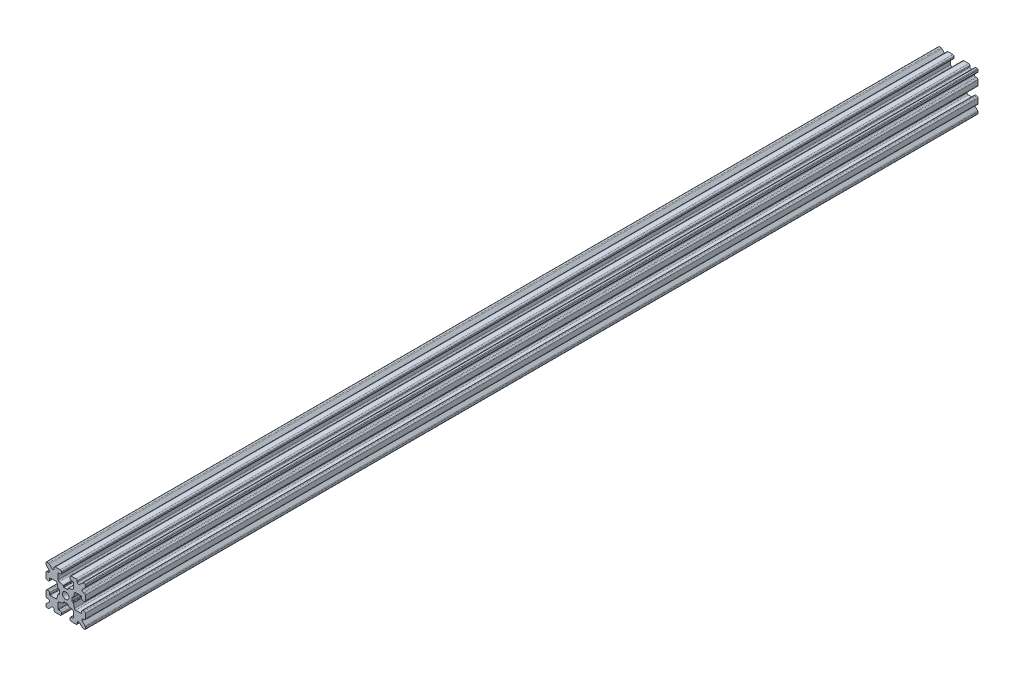
from build123d import *

# Parameters (mm, degrees)
CROQUIS1_R              = 1.25
SALIENTE_EXTRUIR1_DEPTH = 300
CROQUIS2_R              = 1.25
SALIENTE_EXTRUIR2_DEPTH = 40


with BuildPart() as part:
    # Croquis1 → Saliente-Extruir1 (new body)
    with BuildSketch(Plane(origin=(0, 0, -150), x_dir=(-1, 0, 0), z_dir=(0, 0, -1))):
        with BuildLine():
            Line((-2.9, -5.9), (-2.9, -3.80033659))
            ThreePointArc((-2.9, -3.80033659), (-2.790306203, -3.487828881), (-2.509355728, -3.312441801))
            Line((-2.509355728, -3.312441801), (-0.981757709, -2.970049142))
            ThreePointArc((-0.981757709, -2.970049142), (-0.869377519, -2.89989431), (-0.8255, -2.774891226))
            Line((-0.8255, -2.774891226), (-0.8255, -2.5470646))
            ThreePointArc((-0.8255, -2.5470646), (-0.766921356, -2.405643244), (-0.6255, -2.3470646))
            Line((-0.6255, -2.3470646), (0.6255, -2.3470646))
            ThreePointArc((0.6255, -2.3470646), (0.766921356, -2.405643244), (0.8255, -2.5470646))
            Line((0.8255, -2.5470646), (0.8255, -2.774891226))
            ThreePointArc((0.8255, -2.774891226), (0.869377519, -2.89989431), (0.981757709, -2.970049142))
            Line((0.981757709, -2.970049142), (2.509355728, -3.312441801))
            ThreePointArc((2.509355728, -3.312441801), (2.790306203, -3.487828881), (2.9, -3.80033659))
            Line((2.9, -3.80033659), (2.9, -5.9))
            ThreePointArc((2.9, -5.9), (2.841421356, -6.041421356), (2.7, -6.1))
            Line((2.7, -6.1), (2.1, -6.1))
            ThreePointArc((2.1, -6.1), (1.746446609, -6.246446609), (1.6, -6.6))
            Line((1.6, -6.6), (1.6, -7))
            ThreePointArc((1.6, -7), (1.746446609, -7.353553391), (2.1, -7.5))
            Line((2.1, -7.5), (3.9, -7.5))
            ThreePointArc((3.9, -7.5), (4.253553391, -7.353553391), (4.4, -7))
            Line((4.4, -7), (4.4, -6.667766953))
            ThreePointArc((4.4, -6.667766953), (4.708658284, -6.205827187), (5.253553391, -6.314213562))
            Line((5.253553391, -6.314213562), (6.292893219, -7.353553391))
            ThreePointArc((6.292893219, -7.353553391), (6.455104893, -7.461939766), (6.646446609, -7.5))
            Line((6.646446609, -7.5), (7.25, -7.5))
            ThreePointArc((7.25, -7.5), (7.426776695, -7.426776695), (7.5, -7.25))
            Line((7.5, -7.25), (7.5, -6.646446609))
            ThreePointArc((7.5, -6.646446609), (7.461939766, -6.455104893), (7.353553391, -6.292893219))
            Line((7.353553391, -6.292893219), (6.314213562, -5.253553391))
            ThreePointArc((6.314213562, -5.253553391), (6.205827187, -4.708658284), (6.667766953, -4.4))
            Line((6.667766953, -4.4), (7, -4.4))
            ThreePointArc((7, -4.4), (7.353553391, -4.253553391), (7.5, -3.9))
            Line((7.5, -3.9), (7.5, -2.1))
            ThreePointArc((7.5, -2.1), (7.353553391, -1.746446609), (7, -1.6))
            Line((7, -1.6), (6.6, -1.6))
            ThreePointArc((6.6, -1.6), (6.246446609, -1.746446609), (6.1, -2.1))
            Line((6.1, -2.1), (6.1, -2.7))
            ThreePointArc((6.1, -2.7), (6.041421356, -2.841421356), (5.9, -2.9))
            Line((5.9, -2.9), (3.80033659, -2.9))
            ThreePointArc((3.80033659, -2.9), (3.487828881, -2.790306203), (3.312441801, -2.509355728))
            Line((3.312441801, -2.509355728), (2.970049142, -0.981757709))
            ThreePointArc((2.970049142, -0.981757709), (2.89989431, -0.869377519), (2.774891226, -0.8255))
            Line((2.774891226, -0.8255), (2.5470646, -0.8255))
            ThreePointArc((2.5470646, -0.8255), (2.405643244, -0.766921356), (2.3470646, -0.6255))
            Line((2.3470646, -0.6255), (2.3470646, 0.6255))
            ThreePointArc((2.3470646, 0.6255), (2.405643244, 0.766921356), (2.5470646, 0.8255))
            Line((2.5470646, 0.8255), (2.774891226, 0.8255))
            ThreePointArc((2.774891226, 0.8255), (2.89989431, 0.869377519), (2.970049142, 0.981757709))
            Line((2.970049142, 0.981757709), (3.312441801, 2.509355728))
            ThreePointArc((3.312441801, 2.509355728), (3.487828881, 2.790306203), (3.80033659, 2.9))
            Line((3.80033659, 2.9), (5.9, 2.9))
            ThreePointArc((5.9, 2.9), (6.041421356, 2.841421356), (6.1, 2.7))
            Line((6.1, 2.7), (6.1, 2.1))
            ThreePointArc((6.1, 2.1), (6.246446609, 1.746446609), (6.6, 1.6))
            Line((6.6, 1.6), (7, 1.6))
            ThreePointArc((7, 1.6), (7.353553391, 1.746446609), (7.5, 2.1))
            Line((7.5, 2.1), (7.5, 3.9))
            ThreePointArc((7.5, 3.9), (7.353553391, 4.253553391), (7, 4.4))
            Line((7, 4.4), (6.667766953, 4.4))
            ThreePointArc((6.667766953, 4.4), (6.205827187, 4.708658284), (6.314213562, 5.253553391))
            Line((6.314213562, 5.253553391), (7.353553391, 6.292893219))
            ThreePointArc((7.353553391, 6.292893219), (7.461939766, 6.455104893), (7.5, 6.646446609))
            Line((7.5, 6.646446609), (7.5, 7.25))
            ThreePointArc((7.5, 7.25), (7.426776695, 7.426776695), (7.25, 7.5))
            Line((7.25, 7.5), (6.646446609, 7.5))
            ThreePointArc((6.646446609, 7.5), (6.455104893, 7.461939766), (6.292893219, 7.353553391))
            Line((6.292893219, 7.353553391), (5.253553391, 6.314213562))
            ThreePointArc((5.253553391, 6.314213562), (4.708658284, 6.205827187), (4.4, 6.667766953))
            Line((4.4, 6.667766953), (4.4, 7))
            ThreePointArc((4.4, 7), (4.253553391, 7.353553391), (3.9, 7.5))
            Line((3.9, 7.5), (2.1, 7.5))
            ThreePointArc((2.1, 7.5), (1.746446609, 7.353553391), (1.6, 7))
            Line((1.6, 7), (1.6, 6.6))
            ThreePointArc((1.6, 6.6), (1.746446609, 6.246446609), (2.1, 6.1))
            Line((2.1, 6.1), (2.7, 6.1))
            ThreePointArc((2.7, 6.1), (2.841421356, 6.041421356), (2.9, 5.9))
            Line((2.9, 5.9), (2.9, 3.80033659))
            ThreePointArc((2.9, 3.80033659), (2.790306203, 3.487828881), (2.509355728, 3.312441801))
            Line((2.509355728, 3.312441801), (0.981757709, 2.970049142))
            ThreePointArc((0.981757709, 2.970049142), (0.869377519, 2.89989431), (0.8255, 2.774891226))
            Line((0.8255, 2.774891226), (0.8255, 2.5470646))
            ThreePointArc((0.8255, 2.5470646), (0.766921356, 2.405643244), (0.6255, 2.3470646))
            Line((0.6255, 2.3470646), (-0.6255, 2.3470646))
            ThreePointArc((-0.6255, 2.3470646), (-0.766921356, 2.405643244), (-0.8255, 2.5470646))
            Line((-0.8255, 2.5470646), (-0.8255, 2.774891226))
            ThreePointArc((-0.8255, 2.774891226), (-0.869377519, 2.89989431), (-0.981757709, 2.970049142))
            Line((-0.981757709, 2.970049142), (-2.509355728, 3.312441801))
            ThreePointArc((-2.509355728, 3.312441801), (-2.790306203, 3.487828881), (-2.9, 3.80033659))
            Line((-2.9, 3.80033659), (-2.9, 5.9))
            ThreePointArc((-2.9, 5.9), (-2.841421356, 6.041421356), (-2.7, 6.1))
            Line((-2.7, 6.1), (-2.1, 6.1))
            ThreePointArc((-2.1, 6.1), (-1.746446609, 6.246446609), (-1.6, 6.6))
            Line((-1.6, 6.6), (-1.6, 7))
            ThreePointArc((-1.6, 7), (-1.746446609, 7.353553391), (-2.1, 7.5))
            Line((-2.1, 7.5), (-3.9, 7.5))
            ThreePointArc((-3.9, 7.5), (-4.253553391, 7.353553391), (-4.4, 7))
            Line((-4.4, 7), (-4.4, 6.667766953))
            ThreePointArc((-4.4, 6.667766953), (-4.708658284, 6.205827187), (-5.253553391, 6.314213562))
            Line((-5.253553391, 6.314213562), (-6.292893219, 7.353553391))
            ThreePointArc((-6.292893219, 7.353553391), (-6.455104893, 7.461939766), (-6.646446609, 7.5))
            Line((-6.646446609, 7.5), (-7.25, 7.5))
            ThreePointArc((-7.25, 7.5), (-7.426776695, 7.426776695), (-7.5, 7.25))
            Line((-7.5, 7.25), (-7.5, 6.646446609))
            ThreePointArc((-7.5, 6.646446609), (-7.461939766, 6.455104893), (-7.353553391, 6.292893219))
            Line((-7.353553391, 6.292893219), (-6.314213562, 5.253553391))
            ThreePointArc((-6.314213562, 5.253553391), (-6.205827187, 4.708658284), (-6.667766953, 4.4))
            Line((-6.667766953, 4.4), (-7, 4.4))
            ThreePointArc((-7, 4.4), (-7.353553391, 4.253553391), (-7.5, 3.9))
            Line((-7.5, 3.9), (-7.5, 2.1))
            ThreePointArc((-7.5, 2.1), (-7.353553391, 1.746446609), (-7, 1.6))
            Line((-7, 1.6), (-6.6, 1.6))
            ThreePointArc((-6.6, 1.6), (-6.246446609, 1.746446609), (-6.1, 2.1))
            Line((-6.1, 2.1), (-6.1, 2.7))
            ThreePointArc((-6.1, 2.7), (-6.041421356, 2.841421356), (-5.9, 2.9))
            Line((-5.9, 2.9), (-3.80033659, 2.9))
            ThreePointArc((-3.80033659, 2.9), (-3.487828881, 2.790306203), (-3.312441801, 2.509355728))
            Line((-3.312441801, 2.509355728), (-2.970049142, 0.981757709))
            ThreePointArc((-2.970049142, 0.981757709), (-2.89989431, 0.869377519), (-2.774891226, 0.8255))
            Line((-2.774891226, 0.8255), (-2.5470646, 0.8255))
            ThreePointArc((-2.5470646, 0.8255), (-2.405643244, 0.766921356), (-2.3470646, 0.6255))
            Line((-2.3470646, 0.6255), (-2.3470646, -0.6255))
            ThreePointArc((-2.3470646, -0.6255), (-2.405643244, -0.766921356), (-2.5470646, -0.8255))
            Line((-2.5470646, -0.8255), (-2.774891226, -0.8255))
            ThreePointArc((-2.774891226, -0.8255), (-2.89989431, -0.869377519), (-2.970049142, -0.981757709))
            Line((-2.970049142, -0.981757709), (-3.312441801, -2.509355728))
            ThreePointArc((-3.312441801, -2.509355728), (-3.487828881, -2.790306203), (-3.80033659, -2.9))
            Line((-3.80033659, -2.9), (-5.9, -2.9))
            ThreePointArc((-5.9, -2.9), (-6.041421356, -2.841421356), (-6.1, -2.7))
            Line((-6.1, -2.7), (-6.1, -2.1))
            ThreePointArc((-6.1, -2.1), (-6.246446609, -1.746446609), (-6.6, -1.6))
            Line((-6.6, -1.6), (-7, -1.6))
            ThreePointArc((-7, -1.6), (-7.353553391, -1.746446609), (-7.5, -2.1))
            Line((-7.5, -2.1), (-7.5, -3.9))
            ThreePointArc((-7.5, -3.9), (-7.353553391, -4.253553391), (-7, -4.4))
            Line((-7, -4.4), (-6.667766953, -4.4))
            ThreePointArc((-6.667766953, -4.4), (-6.205827187, -4.708658284), (-6.314213562, -5.253553391))
            Line((-6.314213562, -5.253553391), (-7.353553391, -6.292893219))
            ThreePointArc((-7.353553391, -6.292893219), (-7.461939766, -6.455104893), (-7.5, -6.646446609))
            Line((-7.5, -6.646446609), (-7.5, -7.25))
            ThreePointArc((-7.5, -7.25), (-7.426776695, -7.426776695), (-7.25, -7.5))
            Line((-7.25, -7.5), (-6.646446609, -7.5))
            ThreePointArc((-6.646446609, -7.5), (-6.455104893, -7.461939766), (-6.292893219, -7.353553391))
            Line((-6.292893219, -7.353553391), (-5.253553391, -6.314213562))
            ThreePointArc((-5.253553391, -6.314213562), (-4.708658284, -6.205827187), (-4.4, -6.667766953))
            Line((-4.4, -6.667766953), (-4.4, -7))
            ThreePointArc((-4.4, -7), (-4.253553391, -7.353553391), (-3.9, -7.5))
            Line((-3.9, -7.5), (-2.1, -7.5))
            ThreePointArc((-2.1, -7.5), (-1.746446609, -7.353553391), (-1.6, -7))
            Line((-1.6, -7), (-1.6, -6.6))
            ThreePointArc((-1.6, -6.6), (-1.746446609, -6.246446609), (-2.1, -6.1))
            Line((-2.1, -6.1), (-2.7, -6.1))
            ThreePointArc((-2.7, -6.1), (-2.841421356, -6.041421356), (-2.9, -5.9))
        make_face()
        with Locations(Location((0, 0, 0), (0, 0, 180))):
            Circle(CROQUIS1_R, mode=Mode.SUBTRACT)
    extrude(amount=-SALIENTE_EXTRUIR1_DEPTH)

    # Croquis2 → Saliente-Extruir2 (add)
    with BuildSketch(Plane.XY.offset(150)):
        with BuildLine():
            Line((2.7, -6.1), (2.1, -6.1))
            ThreePointArc((2.1, -6.1), (1.746446609, -6.246446609), (1.6, -6.6))
            Line((1.6, -6.6), (1.6, -7))
            ThreePointArc((1.6, -7), (1.746446609, -7.353553391), (2.1, -7.5))
            Line((2.1, -7.5), (3.9, -7.5))
            ThreePointArc((3.9, -7.5), (4.253553391, -7.353553391), (4.4, -7))
            Line((4.4, -7), (4.4, -6.667766953))
            ThreePointArc((4.4, -6.667766953), (4.708658284, -6.205827187), (5.253553391, -6.314213562))
            Line((5.253553391, -6.314213562), (6.292893219, -7.353553391))
            ThreePointArc((6.292893219, -7.353553391), (6.455104893, -7.461939766), (6.646446609, -7.5))
            Line((6.646446609, -7.5), (7.25, -7.5))
            ThreePointArc((7.25, -7.5), (7.426776695, -7.426776695), (7.5, -7.25))
            Line((7.5, -7.25), (7.5, -6.646446609))
            ThreePointArc((7.5, -6.646446609), (7.461939766, -6.455104893), (7.353553391, -6.292893219))
            Line((7.353553391, -6.292893219), (6.314213562, -5.253553391))
            ThreePointArc((6.314213562, -5.253553391), (6.205827187, -4.708658284), (6.667766953, -4.4))
            Line((6.667766953, -4.4), (7, -4.4))
            ThreePointArc((7, -4.4), (7.353553391, -4.253553391), (7.5, -3.9))
            Line((7.5, -3.9), (7.5, -2.1))
            ThreePointArc((7.5, -2.1), (7.353553391, -1.746446609), (7, -1.6))
            Line((7, -1.6), (6.6, -1.6))
            ThreePointArc((6.6, -1.6), (6.246446609, -1.746446609), (6.1, -2.1))
            Line((6.1, -2.1), (6.1, -2.7))
            ThreePointArc((6.1, -2.7), (6.041421356, -2.841421356), (5.9, -2.9))
            Line((5.9, -2.9), (3.80033659, -2.9))
            ThreePointArc((3.80033659, -2.9), (3.487828881, -2.790306203), (3.312441801, -2.509355728))
            Line((3.312441801, -2.509355728), (2.970049142, -0.981757709))
            ThreePointArc((2.970049142, -0.981757709), (2.89989431, -0.869377519), (2.774891226, -0.8255))
            Line((2.774891226, -0.8255), (2.5470646, -0.8255))
            ThreePointArc((2.5470646, -0.8255), (2.405643244, -0.766921356), (2.3470646, -0.6255))
            Line((2.3470646, -0.6255), (2.3470646, 0.6255))
            ThreePointArc((2.3470646, 0.6255), (2.405643244, 0.766921356), (2.5470646, 0.8255))
            Line((2.5470646, 0.8255), (2.774891226, 0.8255))
            ThreePointArc((2.774891226, 0.8255), (2.89989431, 0.869377519), (2.970049142, 0.981757709))
            Line((2.970049142, 0.981757709), (3.312441801, 2.509355728))
            ThreePointArc((3.312441801, 2.509355728), (3.487828881, 2.790306203), (3.80033659, 2.9))
            Line((3.80033659, 2.9), (5.9, 2.9))
            ThreePointArc((5.9, 2.9), (6.041421356, 2.841421356), (6.1, 2.7))
            Line((6.1, 2.7), (6.1, 2.1))
            ThreePointArc((6.1, 2.1), (6.246446609, 1.746446609), (6.6, 1.6))
            Line((6.6, 1.6), (7, 1.6))
            ThreePointArc((7, 1.6), (7.353553391, 1.746446609), (7.5, 2.1))
            Line((7.5, 2.1), (7.5, 3.9))
            ThreePointArc((7.5, 3.9), (7.353553391, 4.253553391), (7, 4.4))
            Line((7, 4.4), (6.667766953, 4.4))
            ThreePointArc((6.667766953, 4.4), (6.205827187, 4.708658284), (6.314213562, 5.253553391))
            Line((6.314213562, 5.253553391), (7.353553391, 6.292893219))
            ThreePointArc((7.353553391, 6.292893219), (7.461939766, 6.455104893), (7.5, 6.646446609))
            Line((7.5, 6.646446609), (7.5, 7.25))
            ThreePointArc((7.5, 7.25), (7.426776695, 7.426776695), (7.25, 7.5))
            Line((7.25, 7.5), (6.646446609, 7.5))
            ThreePointArc((6.646446609, 7.5), (6.455104893, 7.461939766), (6.292893219, 7.353553391))
            Line((6.292893219, 7.353553391), (5.253553391, 6.314213562))
            ThreePointArc((5.253553391, 6.314213562), (4.708658284, 6.205827187), (4.4, 6.667766953))
            Line((4.4, 6.667766953), (4.4, 7))
            ThreePointArc((4.4, 7), (4.253553391, 7.353553391), (3.9, 7.5))
            Line((3.9, 7.5), (2.1, 7.5))
            ThreePointArc((2.1, 7.5), (1.746446609, 7.353553391), (1.6, 7))
            Line((1.6, 7), (1.6, 6.6))
            ThreePointArc((1.6, 6.6), (1.746446609, 6.246446609), (2.1, 6.1))
            Line((2.1, 6.1), (2.7, 6.1))
            ThreePointArc((2.7, 6.1), (2.841421356, 6.041421356), (2.9, 5.9))
            Line((2.9, 5.9), (2.9, 3.80033659))
            ThreePointArc((2.9, 3.80033659), (2.790306203, 3.487828881), (2.509355728, 3.312441801))
            Line((2.509355728, 3.312441801), (0.981757709, 2.970049142))
            ThreePointArc((0.981757709, 2.970049142), (0.869377519, 2.89989431), (0.8255, 2.774891226))
            Line((0.8255, 2.774891226), (0.8255, 2.5470646))
            ThreePointArc((0.8255, 2.5470646), (0.766921356, 2.405643244), (0.6255, 2.3470646))
            Line((0.6255, 2.3470646), (-0.6255, 2.3470646))
            ThreePointArc((-0.6255, 2.3470646), (-0.766921356, 2.405643244), (-0.8255, 2.5470646))
            Line((-0.8255, 2.5470646), (-0.8255, 2.774891226))
            ThreePointArc((-0.8255, 2.774891226), (-0.869377519, 2.89989431), (-0.981757709, 2.970049142))
            Line((-0.981757709, 2.970049142), (-2.509355728, 3.312441801))
            ThreePointArc((-2.509355728, 3.312441801), (-2.790306203, 3.487828881), (-2.9, 3.80033659))
            Line((-2.9, 3.80033659), (-2.9, 5.9))
            ThreePointArc((-2.9, 5.9), (-2.841421356, 6.041421356), (-2.7, 6.1))
            Line((-2.7, 6.1), (-2.1, 6.1))
            ThreePointArc((-2.1, 6.1), (-1.746446609, 6.246446609), (-1.6, 6.6))
            Line((-1.6, 6.6), (-1.6, 7))
            ThreePointArc((-1.6, 7), (-1.746446609, 7.353553391), (-2.1, 7.5))
            Line((-2.1, 7.5), (-3.9, 7.5))
            ThreePointArc((-3.9, 7.5), (-4.253553391, 7.353553391), (-4.4, 7))
            Line((-4.4, 7), (-4.4, 6.667766953))
            ThreePointArc((-4.4, 6.667766953), (-4.708658284, 6.205827187), (-5.253553391, 6.314213562))
            Line((-5.253553391, 6.314213562), (-6.292893219, 7.353553391))
            ThreePointArc((-6.292893219, 7.353553391), (-6.455104893, 7.461939766), (-6.646446609, 7.5))
            Line((-6.646446609, 7.5), (-7.25, 7.5))
            ThreePointArc((-7.25, 7.5), (-7.426776695, 7.426776695), (-7.5, 7.25))
            Line((-7.5, 7.25), (-7.5, 6.646446609))
            ThreePointArc((-7.5, 6.646446609), (-7.461939766, 6.455104893), (-7.353553391, 6.292893219))
            Line((-7.353553391, 6.292893219), (-6.314213562, 5.253553391))
            ThreePointArc((-6.314213562, 5.253553391), (-6.205827187, 4.708658284), (-6.667766953, 4.4))
            Line((-6.667766953, 4.4), (-7, 4.4))
            ThreePointArc((-7, 4.4), (-7.353553391, 4.253553391), (-7.5, 3.9))
            Line((-7.5, 3.9), (-7.5, 2.1))
            ThreePointArc((-7.5, 2.1), (-7.353553391, 1.746446609), (-7, 1.6))
            Line((-7, 1.6), (-6.6, 1.6))
            ThreePointArc((-6.6, 1.6), (-6.246446609, 1.746446609), (-6.1, 2.1))
            Line((-6.1, 2.1), (-6.1, 2.7))
            ThreePointArc((-6.1, 2.7), (-6.041421356, 2.841421356), (-5.9, 2.9))
            Line((-5.9, 2.9), (-3.80033659, 2.9))
            ThreePointArc((-3.80033659, 2.9), (-3.487828881, 2.790306203), (-3.312441801, 2.509355728))
            Line((-3.312441801, 2.509355728), (-2.970049142, 0.981757709))
            ThreePointArc((-2.970049142, 0.981757709), (-2.89989431, 0.869377519), (-2.774891226, 0.8255))
            Line((-2.774891226, 0.8255), (-2.5470646, 0.8255))
            ThreePointArc((-2.5470646, 0.8255), (-2.405643244, 0.766921356), (-2.3470646, 0.6255))
            Line((-2.3470646, 0.6255), (-2.3470646, -0.6255))
            ThreePointArc((-2.3470646, -0.6255), (-2.405643244, -0.766921356), (-2.5470646, -0.8255))
            Line((-2.5470646, -0.8255), (-2.774891226, -0.8255))
            ThreePointArc((-2.774891226, -0.8255), (-2.89989431, -0.869377519), (-2.970049142, -0.981757709))
            Line((-2.970049142, -0.981757709), (-3.312441801, -2.509355728))
            ThreePointArc((-3.312441801, -2.509355728), (-3.487828881, -2.790306203), (-3.80033659, -2.9))
            Line((-3.80033659, -2.9), (-5.9, -2.9))
            ThreePointArc((-5.9, -2.9), (-6.041421356, -2.841421356), (-6.1, -2.7))
            Line((-6.1, -2.7), (-6.1, -2.1))
            ThreePointArc((-6.1, -2.1), (-6.246446609, -1.746446609), (-6.6, -1.6))
            Line((-6.6, -1.6), (-7, -1.6))
            ThreePointArc((-7, -1.6), (-7.353553391, -1.746446609), (-7.5, -2.1))
            Line((-7.5, -2.1), (-7.5, -3.9))
            ThreePointArc((-7.5, -3.9), (-7.353553391, -4.253553391), (-7, -4.4))
            Line((-7, -4.4), (-6.667766953, -4.4))
            ThreePointArc((-6.667766953, -4.4), (-6.205827187, -4.708658284), (-6.314213562, -5.253553391))
            Line((-6.314213562, -5.253553391), (-7.353553391, -6.292893219))
            ThreePointArc((-7.353553391, -6.292893219), (-7.461939766, -6.455104893), (-7.5, -6.646446609))
            Line((-7.5, -6.646446609), (-7.5, -7.25))
            ThreePointArc((-7.5, -7.25), (-7.426776695, -7.426776695), (-7.25, -7.5))
            Line((-7.25, -7.5), (-6.646446609, -7.5))
            ThreePointArc((-6.646446609, -7.5), (-6.455104893, -7.461939766), (-6.292893219, -7.353553391))
            Line((-6.292893219, -7.353553391), (-5.253553391, -6.314213562))
            ThreePointArc((-5.253553391, -6.314213562), (-4.708658284, -6.205827187), (-4.4, -6.667766953))
            Line((-4.4, -6.667766953), (-4.4, -7))
            ThreePointArc((-4.4, -7), (-4.253553391, -7.353553391), (-3.9, -7.5))
            Line((-3.9, -7.5), (-2.1, -7.5))
            ThreePointArc((-2.1, -7.5), (-1.746446609, -7.353553391), (-1.6, -7))
            Line((-1.6, -7), (-1.6, -6.6))
            ThreePointArc((-1.6, -6.6), (-1.746446609, -6.246446609), (-2.1, -6.1))
            Line((-2.1, -6.1), (-2.7, -6.1))
            ThreePointArc((-2.7, -6.1), (-2.841421356, -6.041421356), (-2.9, -5.9))
            Line((-2.9, -5.9), (-2.9, -3.80033659))
            ThreePointArc((-2.9, -3.80033659), (-2.790306203, -3.487828881), (-2.509355728, -3.312441801))
            Line((-2.509355728, -3.312441801), (-0.981757709, -2.970049142))
            ThreePointArc((-0.981757709, -2.970049142), (-0.869377519, -2.89989431), (-0.8255, -2.774891226))
            Line((-0.8255, -2.774891226), (-0.8255, -2.5470646))
            ThreePointArc((-0.8255, -2.5470646), (-0.766921356, -2.405643244), (-0.6255, -2.3470646))
            Line((-0.6255, -2.3470646), (0.6255, -2.3470646))
            ThreePointArc((0.6255, -2.3470646), (0.766921356, -2.405643244), (0.8255, -2.5470646))
            Line((0.8255, -2.5470646), (0.8255, -2.774891226))
            ThreePointArc((0.8255, -2.774891226), (0.869377519, -2.89989431), (0.981757709, -2.970049142))
            Line((0.981757709, -2.970049142), (2.509355728, -3.312441801))
            ThreePointArc((2.509355728, -3.312441801), (2.790306203, -3.487828881), (2.9, -3.80033659))
            Line((2.9, -3.80033659), (2.9, -5.9))
            ThreePointArc((2.9, -5.9), (2.841421356, -6.041421356), (2.7, -6.1))
        make_face()
        Circle(CROQUIS2_R, mode=Mode.SUBTRACT)
    extrude(amount=SALIENTE_EXTRUIR2_DEPTH)


solid = part.part
